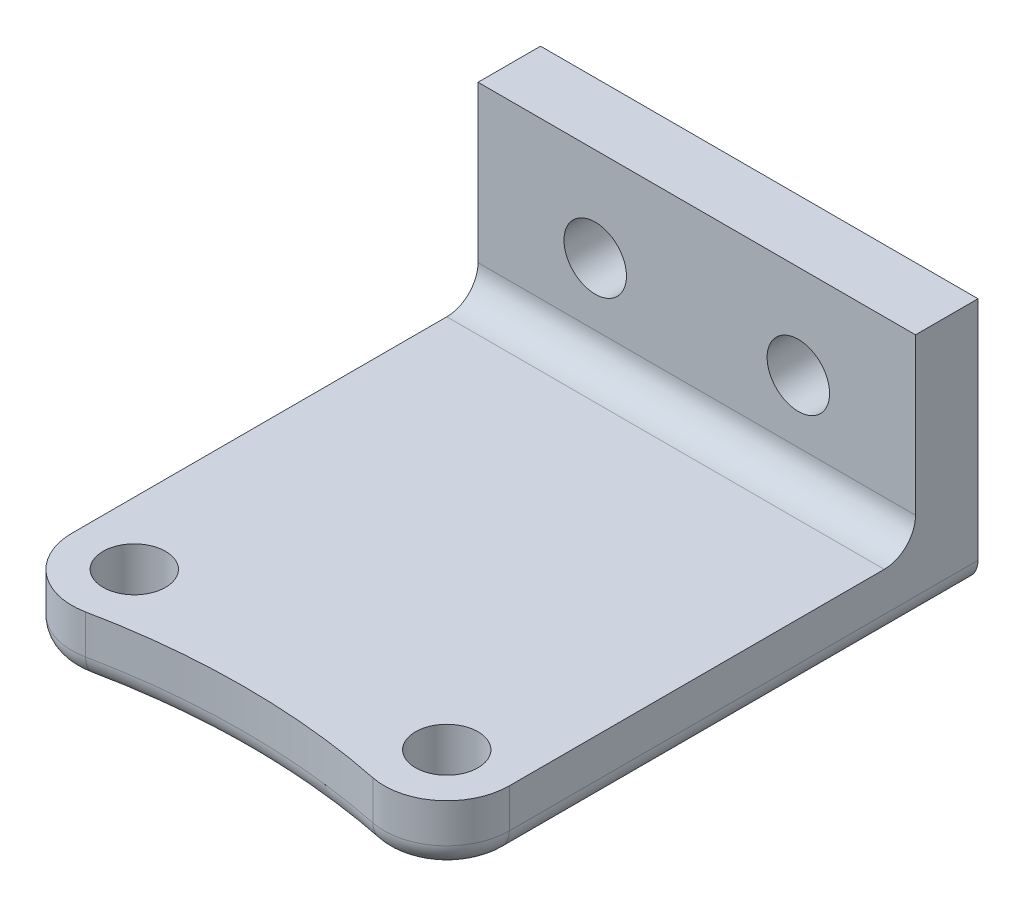
from build123d import *

# Parameters (mm, degrees)
SKETCH1_R           = 2
BOSS_EXTRUDE1_DEPTH = 4
SKETCH2_W           = 28
SKETCH2_H           = 4
BOSS_EXTRUDE2_DEPTH = 12
SKETCH3_R           = 2
CUT_EXTRUDE1_DEPTH  = 4
FILLET1_R           = 1.5
FILLET2_R           = 2


with BuildPart() as part:
    # Sketch1 → Boss-Extrude1 (new body)
    with BuildSketch(Plane(origin=(0, 0, 0), x_dir=(1, 0, 0), z_dir=(0, 1, 0))):
        with BuildLine():
            Line((-4, 0), (-4, 30))
            Line((-4, 30), (24, 30))
            Line((24, 30), (24, 0))
            ThreePointArc((24, 0), (22.528430811, -3.099522162), (19.196481184, -3.918463667))
            ThreePointArc((19.196481184, -3.918463667), (10, -2.985259199), (0.803518816, -3.918463667))
            ThreePointArc((0.803518816, -3.918463667), (-2.528430811, -3.099522162), (-4, 0))
        make_face()
        with Locations(Location((0, 0, 0), (0, 0, 270))):
            Circle(SKETCH1_R, mode=Mode.SUBTRACT)
        with Locations(Location((20, 0, 0), (0, 0, 270))):
            Circle(SKETCH1_R, mode=Mode.SUBTRACT)
    extrude(amount=BOSS_EXTRUDE1_DEPTH)

    # Sketch2 → Boss-Extrude2 (add)
    with BuildSketch(Plane(origin=(0, 4, 0), x_dir=(1, 0, 0), z_dir=(0, 1, 0))):
        with Locations((10, 28)):
            Rectangle(SKETCH2_W, SKETCH2_H)
    extrude(amount=BOSS_EXTRUDE2_DEPTH)

    # Sketch3 → Cut-Extrude1 (cut)
    with BuildSketch(Plane.XY.offset(-26)):
        with Locations((3.5, 10)):
            Circle(SKETCH3_R)
        with Locations((16.5, 10)):
            Circle(SKETCH3_R)
    extrude(amount=-CUT_EXTRUDE1_DEPTH, mode=Mode.SUBTRACT)

    # Fillet1
    fillet1_edges = [part.edges().sort_by_distance(p)[0] for p in [
        (-2.528430811, 0, 3.099522162),
        (-4, 0, -15),
        (24, 0, -15),
        (22.528430811, 0, 3.099522162),
        (10, 0, 2.985259199),
    ]]
    fillet(fillet1_edges, radius=FILLET1_R)

    # Fillet2
    fillet2_edges = [part.edges().sort_by_distance(p)[0] for p in [
        (10, 4, -26),
    ]]
    fillet(fillet2_edges, radius=FILLET2_R)


solid = part.part
